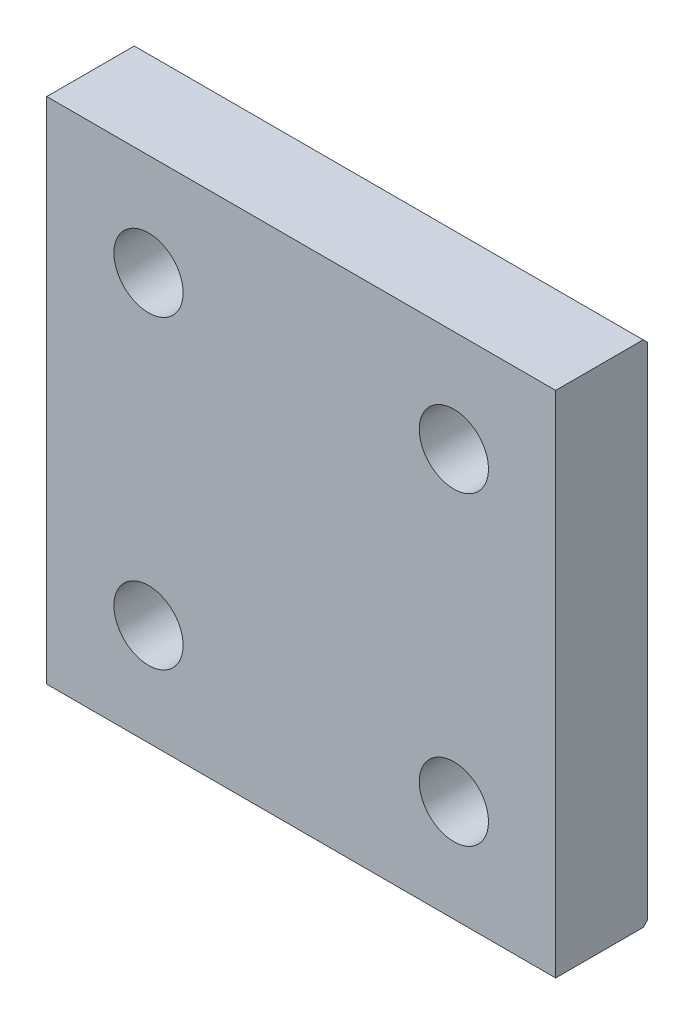
from build123d import *

# Parameters (mm, degrees)
SKETCH_1_W                  = 25
SKETCH_1_H                  = 25
EXTRUDE_1_DEPTH             = 4.5
SKETCH_2_R                  = 1.7
CUT_EXTRUDE_1_DEPTH         = 19.241436347
PATTERN_LINEAR_1_COUNT      = 2
PATTERN_LINEAR_1_PITCH      = 15
PATTERN_LINEAR_1_COUNT_DIR2 = 2
PATTERN_LINEAR_1_PITCH_DIR2 = 15
CHAMFER_1_SIZE              = 0.2


with BuildPart() as part:
    # 草圖1 → 填料-伸長1 (new body)
    with BuildSketch(Plane.XY):
        Rectangle(SKETCH_1_W, SKETCH_1_H)
    extrude(amount=EXTRUDE_1_DEPTH)

    # 草圖2 → 除料-伸長1 (cut, through all)
    with BuildSketch(Plane(origin=(0, 0, 0), x_dir=(-1, 0, 0), z_dir=(0, 0, -1))):
        with Locations((-7.5, 7.5)):
            Circle(SKETCH_2_R)
    cut_extrude_1 = extrude(amount=-CUT_EXTRUDE_1_DEPTH, mode=Mode.SUBTRACT)

    # 直線複製排列1: Cut-Extrude 1 2 × 2
    with Locations(*[(-i * PATTERN_LINEAR_1_PITCH, -j * PATTERN_LINEAR_1_PITCH_DIR2, 0) for i in range(PATTERN_LINEAR_1_COUNT) for j in range(PATTERN_LINEAR_1_COUNT_DIR2) if (i, j) != (0, 0)]):
        add(cut_extrude_1, mode=Mode.SUBTRACT)

    # 導角1
    chamfer_1_edges = [part.edges().sort_by_distance(p)[0] for p in [
        (9.2, 7.5, 0),
        (-5.8, 7.5, 0),
        (9.2, -7.5, 0),
        (-5.8, -7.5, 0),
        (0, 12.5, 0),
        (0, -12.5, 0),
    ]]
    chamfer(chamfer_1_edges, length=CHAMFER_1_SIZE)


solid = part.part
